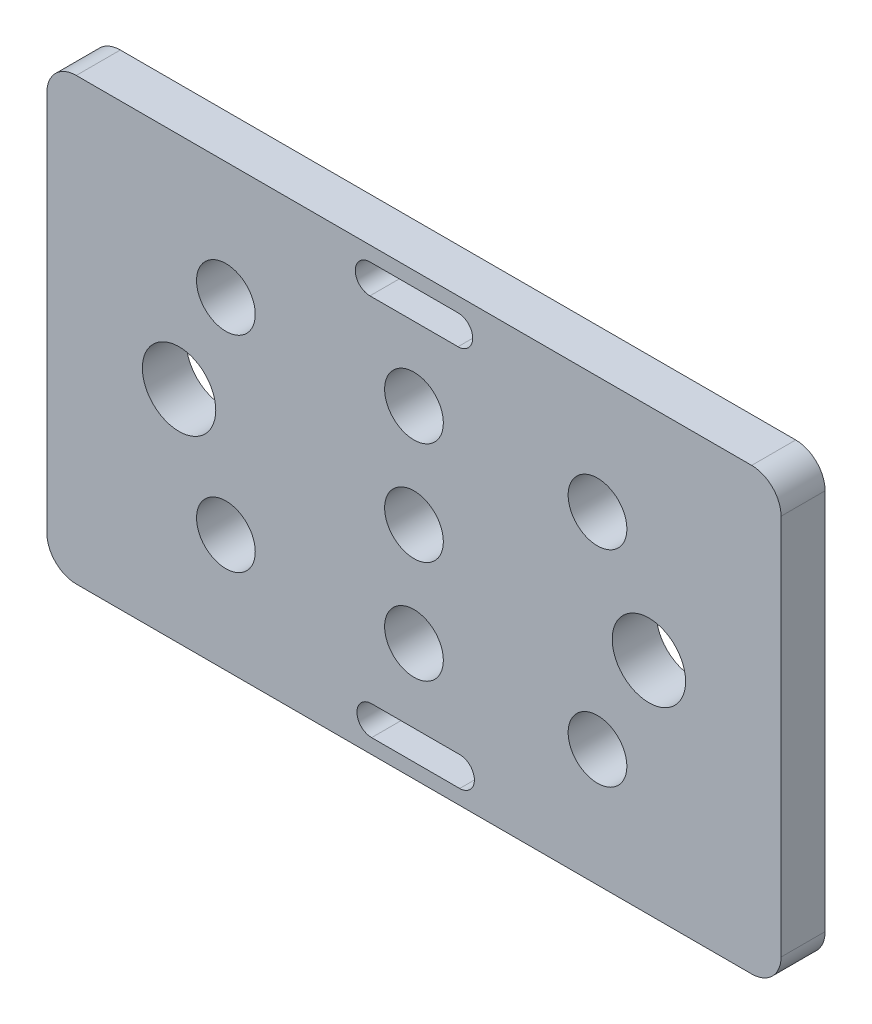
from build123d import *

# Parameters (mm, degrees)
MODEL_R             = 2
MODEL_R_2           = 2.5
BOSS_EXTRUDE1_DEPTH = 3


with BuildPart() as part:
    # Model → Boss-Extrude1 (new body)
    with BuildSketch(Plane.XY):
        with BuildLine():
            Line((-2, 30), (-48, 30))
            ThreePointArc((-48, 30), (-49.414213562, 29.414213562), (-50, 28))
            Line((-50, 28), (-50, 2))
            ThreePointArc((-50, 2), (-49.414213562, 0.585786438), (-48, 0))
            Line((-48, 0), (-2, 0))
            ThreePointArc((-2, 0), (-0.585786438, 0.585786438), (0, 2))
            Line((0, 2), (0, 28))
            ThreePointArc((0, 28), (-0.585786438, 29.414213562), (-2, 30))
        make_face()
        with Locations((-25, 15)):
            Circle(MODEL_R, mode=Mode.SUBTRACT)
        with Locations((-37.81005651, 8)):
            Circle(MODEL_R, mode=Mode.SUBTRACT)
        with Locations((-12.5, 8)):
            Circle(MODEL_R, mode=Mode.SUBTRACT)
        with Locations((-37.81005651, 22)):
            Circle(MODEL_R, mode=Mode.SUBTRACT)
        with Locations((-12.5, 22)):
            Circle(MODEL_R, mode=Mode.SUBTRACT)
        with Locations((-25, 8)):
            Circle(MODEL_R, mode=Mode.SUBTRACT)
        with Locations((-25, 22)):
            Circle(MODEL_R, mode=Mode.SUBTRACT)
        with Locations((-9, 15)):
            Circle(MODEL_R_2, mode=Mode.SUBTRACT)
        with Locations((-41, 15)):
            Circle(MODEL_R_2, mode=Mode.SUBTRACT)
        with BuildLine():
            Line((-21.884771632, 1), (-27.884771632, 1))
            ThreePointArc((-27.884771632, 1), (-28.884771632, 2), (-27.884771632, 3))
            Line((-27.884771632, 3), (-21.884771632, 3))
            ThreePointArc((-21.884771632, 3), (-20.884771632, 2), (-21.884771632, 1))
        make_face(mode=Mode.SUBTRACT)
        with BuildLine():
            Line((-28, 28.999828109), (-22, 28.999828109))
            ThreePointArc((-22, 28.999828109), (-21, 27.999828109), (-22, 26.999828109))
            Line((-22, 26.999828109), (-28, 26.999828109))
            ThreePointArc((-28, 26.999828109), (-29, 27.999828109), (-28, 28.999828109))
        make_face(mode=Mode.SUBTRACT)
    extrude(amount=BOSS_EXTRUDE1_DEPTH)


solid = part.part
